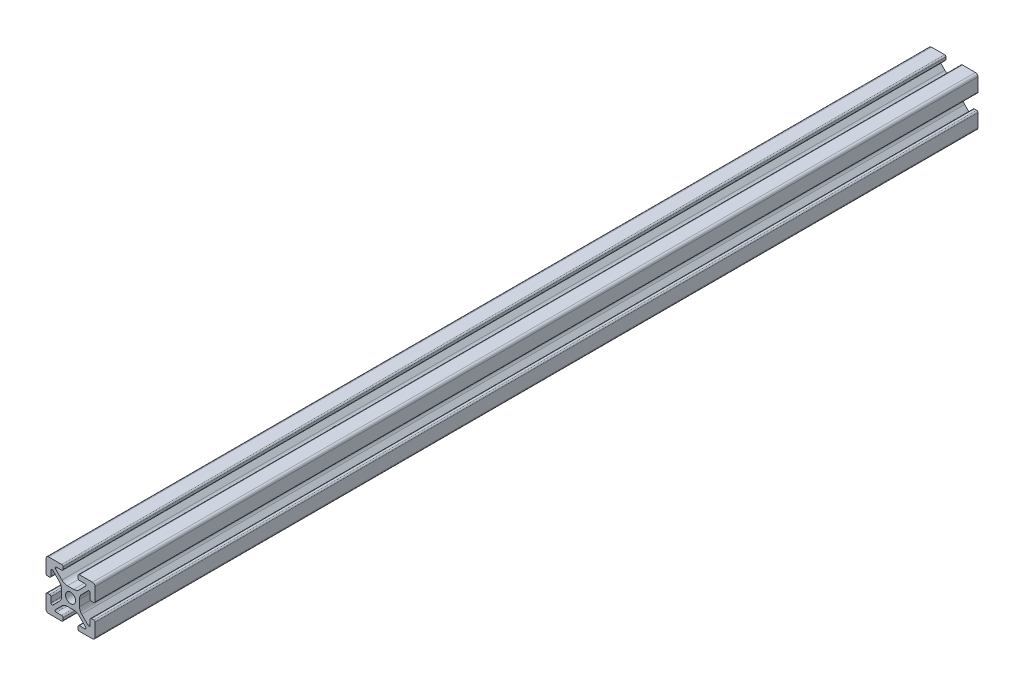
from build123d import *

# Parameters (mm, degrees)
SKETCH2_R           = 2.05
BOSS_EXTRUDE1_DEPTH = 360
SKETCH3_R           = 2.75
CUT_EXTRUDE1_DEPTH  = 34


with BuildPart() as part:
    # Sketch2 → Boss-Extrude1 (new body)
    with BuildSketch(Plane.XY):
        with BuildLine():
            Line((-3.642230561, 1.287773026), (-3.642230561, -1.287773026))
            ThreePointArc((-3.642230561, -1.287773026), (-3.87999308, -2.483085929), (-4.55708345, -3.496423279))
            Line((-4.55708345, -3.496423279), (-7.182004606, -6.121344434))
            ThreePointArc((-7.182004606, -6.121344434), (-7.704200045, -6.225215565), (-8, -5.782519648))
            Line((-8, -5.782519648), (-8, -3.622007668))
            ThreePointArc((-8, -3.622007668), (-8.161974206, -3.230967343), (-8.553014531, -3.068993137))
            Line((-8.553014531, -3.068993137), (-9.443284204, -3.068993137))
            ThreePointArc((-9.443284204, -3.068993137), (-9.836715763, -3.229656566), (-10, -3.622007668))
            Line((-10, -3.622007668), (-10, -8.939033256))
            ThreePointArc((-10, -8.939033256), (-9.689250035, -9.689250035), (-8.939033256, -10))
            Line((-8.939033256, -10), (-3.622007668, -10))
            ThreePointArc((-3.622007668, -10), (-3.229656566, -9.836715763), (-3.068993137, -9.443284204))
            Line((-3.068993137, -9.443284204), (-3.068993137, -8.553014531))
            ThreePointArc((-3.068993137, -8.553014531), (-3.230967343, -8.161974206), (-3.622007668, -8))
            Line((-3.622007668, -8), (-5.782519648, -8))
            ThreePointArc((-5.782519648, -8), (-6.225215565, -7.704200045), (-6.121344434, -7.182004606))
            Line((-6.121344434, -7.182004606), (-3.496423279, -4.55708345))
            ThreePointArc((-3.496423279, -4.55708345), (-2.483085929, -3.87999308), (-1.287773026, -3.642230561))
            Line((-1.287773026, -3.642230561), (1.287773026, -3.642230561))
            ThreePointArc((1.287773026, -3.642230561), (2.483085929, -3.87999308), (3.496423279, -4.55708345))
            Line((3.496423279, -4.55708345), (6.121344434, -7.182004606))
            ThreePointArc((6.121344434, -7.182004606), (6.225215565, -7.704200045), (5.782519648, -8))
            Line((5.782519648, -8), (3.622007668, -8))
            ThreePointArc((3.622007668, -8), (3.230967343, -8.161974206), (3.068993137, -8.553014531))
            Line((3.068993137, -8.553014531), (3.068993137, -9.443284204))
            ThreePointArc((3.068993137, -9.443284204), (3.229656566, -9.836715763), (3.622007668, -10))
            Line((3.622007668, -10), (8.939033256, -10))
            ThreePointArc((8.939033256, -10), (9.689250035, -9.689250035), (10, -8.939033256))
            Line((10, -8.939033256), (10, -3.622007668))
            ThreePointArc((10, -3.622007668), (9.836715763, -3.229656566), (9.443284204, -3.068993137))
            Line((9.443284204, -3.068993137), (8.553014531, -3.068993137))
            ThreePointArc((8.553014531, -3.068993137), (8.161974206, -3.230967343), (8, -3.622007668))
            Line((8, -3.622007668), (8, -5.782519648))
            ThreePointArc((8, -5.782519648), (7.704200045, -6.225215565), (7.182004606, -6.121344434))
            Line((7.182004606, -6.121344434), (4.55708345, -3.496423279))
            ThreePointArc((4.55708345, -3.496423279), (3.87999308, -2.483085929), (3.642230561, -1.287773026))
            Line((3.642230561, -1.287773026), (3.642230561, 1.287773026))
            ThreePointArc((3.642230561, 1.287773026), (3.87999308, 2.483085929), (4.55708345, 3.496423279))
            Line((4.55708345, 3.496423279), (7.182004606, 6.121344434))
            ThreePointArc((7.182004606, 6.121344434), (7.704200045, 6.225215565), (8, 5.782519648))
            Line((8, 5.782519648), (8, 3.622007668))
            ThreePointArc((8, 3.622007668), (8.161974206, 3.230967343), (8.553014531, 3.068993137))
            Line((8.553014531, 3.068993137), (9.443284204, 3.068993137))
            ThreePointArc((9.443284204, 3.068993137), (9.836715763, 3.229656566), (10, 3.622007668))
            Line((10, 3.622007668), (10, 8.939033256))
            ThreePointArc((10, 8.939033256), (9.689250035, 9.689250035), (8.939033256, 10))
            Line((8.939033256, 10), (3.622007668, 10))
            ThreePointArc((3.622007668, 10), (3.229656566, 9.836715763), (3.068993137, 9.443284204))
            Line((3.068993137, 9.443284204), (3.068993137, 8.553014531))
            ThreePointArc((3.068993137, 8.553014531), (3.230967343, 8.161974206), (3.622007668, 8))
            Line((3.622007668, 8), (5.782519648, 8))
            ThreePointArc((5.782519648, 8), (6.225215565, 7.704200045), (6.121344434, 7.182004606))
            Line((6.121344434, 7.182004606), (3.496423279, 4.55708345))
            ThreePointArc((3.496423279, 4.55708345), (2.483085929, 3.87999308), (1.287773026, 3.642230561))
            Line((1.287773026, 3.642230561), (-1.287773026, 3.642230561))
            ThreePointArc((-1.287773026, 3.642230561), (-2.483085929, 3.87999308), (-3.496423279, 4.55708345))
            Line((-3.496423279, 4.55708345), (-6.121344434, 7.182004606))
            ThreePointArc((-6.121344434, 7.182004606), (-6.225215565, 7.704200045), (-5.782519648, 8))
            Line((-5.782519648, 8), (-3.622007668, 8))
            ThreePointArc((-3.622007668, 8), (-3.230967343, 8.161974206), (-3.068993137, 8.553014531))
            Line((-3.068993137, 8.553014531), (-3.068993137, 9.443284204))
            ThreePointArc((-3.068993137, 9.443284204), (-3.229656566, 9.836715763), (-3.622007668, 10))
            Line((-3.622007668, 10), (-8.939033256, 10))
            ThreePointArc((-8.939033256, 10), (-9.689250035, 9.689250035), (-10, 8.939033256))
            Line((-10, 8.939033256), (-10, 3.622007668))
            ThreePointArc((-10, 3.622007668), (-9.836715763, 3.229656566), (-9.443284204, 3.068993137))
            Line((-9.443284204, 3.068993137), (-8.553014531, 3.068993137))
            ThreePointArc((-8.553014531, 3.068993137), (-8.161974206, 3.230967343), (-8, 3.622007668))
            Line((-8, 3.622007668), (-8, 5.782519648))
            ThreePointArc((-8, 5.782519648), (-7.704200045, 6.225215565), (-7.182004606, 6.121344434))
            Line((-7.182004606, 6.121344434), (-4.55708345, 3.496423279))
            ThreePointArc((-4.55708345, 3.496423279), (-3.87999308, 2.483085929), (-3.642230561, 1.287773026))
        make_face()
        Circle(SKETCH2_R, mode=Mode.SUBTRACT)
    extrude(amount=-BOSS_EXTRUDE1_DEPTH)

    # Sketch3 → Cut-Extrude1 (cut)
    with BuildSketch(Plane(origin=(0, 10, 0), x_dir=(1, 0, 0), z_dir=(0, 1, 0))):
        with Locations(Location((0, 110, 0), (0, 0, 297.922776764))):
            Circle(SKETCH3_R)
    extrude(amount=-CUT_EXTRUDE1_DEPTH, mode=Mode.SUBTRACT)


solid = part.part
